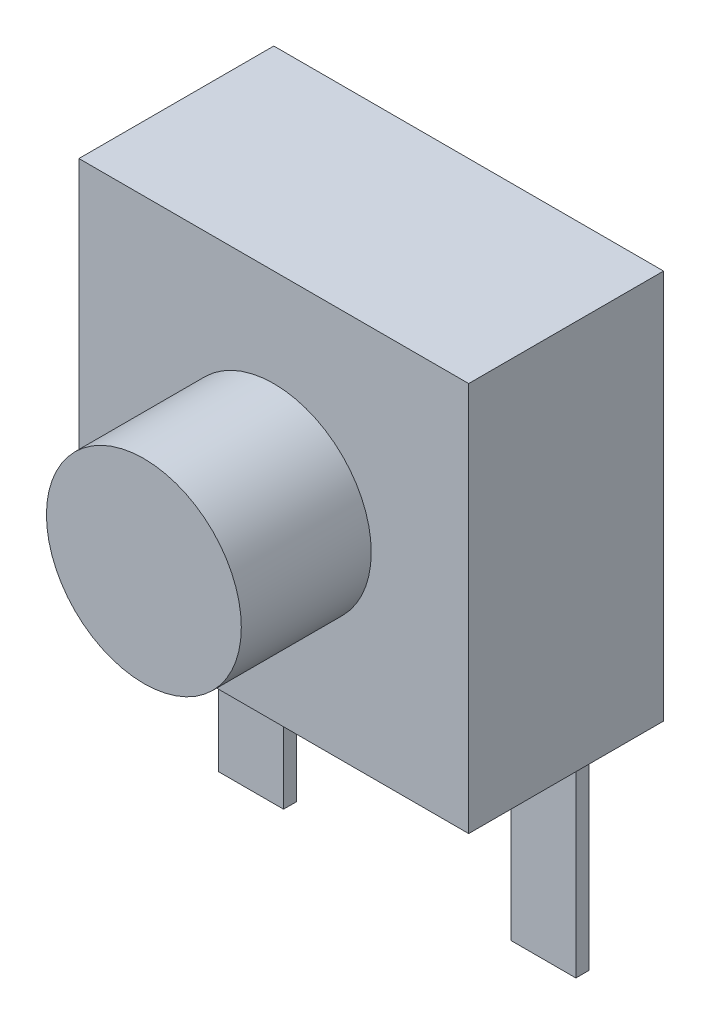
from build123d import *

# Parameters (mm, degrees)
SKETCH_1_W      = 6
SKETCH_1_H      = 6
EXTRUDE_1_DEPTH = 3
SKETCH_2_R      = 1.5
EXTRUDE_2_DEPTH = 2
SKETCH_4_W      = 1
SKETCH_4_H      = 0.2


with BuildPart() as part:
    # 草图1 → 凸台-拉伸1 (new body)
    with BuildSketch(Plane.XY):
        Rectangle(SKETCH_1_W, SKETCH_1_H)
    extrude(amount=EXTRUDE_1_DEPTH)

    # 草图2 → 凸台-拉伸2 (add)
    with BuildSketch(Plane.XY.offset(3)):
        with Locations(Location((0, 0, 0), (0, 0, 180))):
            Circle(SKETCH_2_R)
    extrude(amount=EXTRUDE_2_DEPTH)

    # 扫描3: sweep along a path in 草图6
    with BuildLine(Plane(origin=(2.25, 0, 0), x_dir=(0, 0, -1), z_dir=(1, 0, 0))) as sweep_3_path:
        Line((-1.1, -3), (-1.1, -6))
    # 草图4 → 扫描3 (sweep)
    with BuildSketch(Plane.XZ.offset(3)):
        with Locations((2.25, 1)):
            Rectangle(SKETCH_4_W, SKETCH_4_H)
    sweep_3 = sweep(path=sweep_3_path.line)

    # 镜向1: 扫描3 across plane
    add(sweep_3.mirror(Plane(origin=(0, 0, 0), x_dir=(0, 0, 1), z_dir=(1, 0, 0))))


solid = part.part
